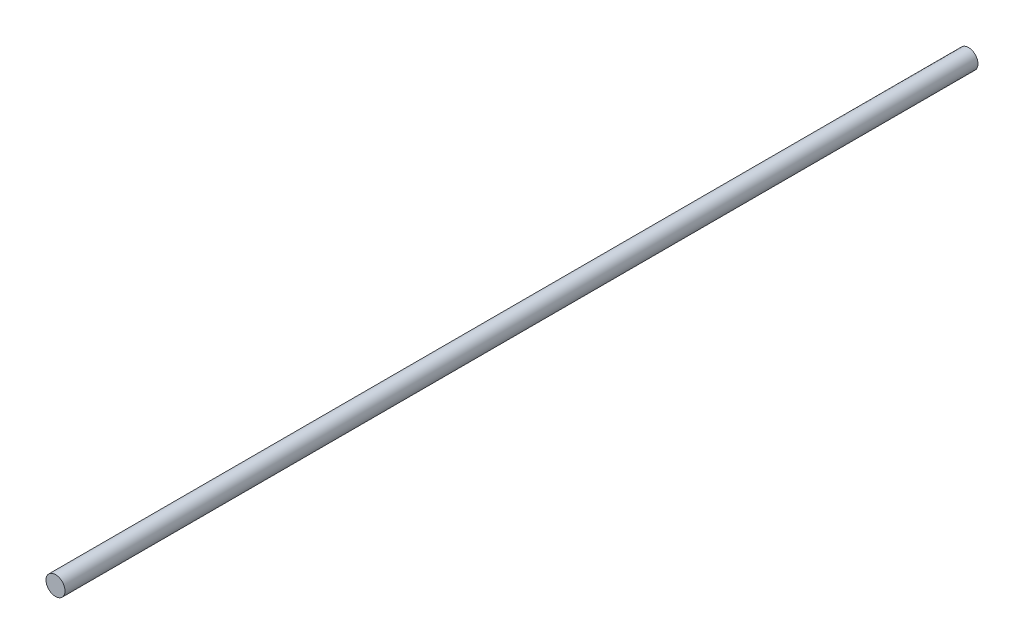
from build123d import *

# Parameters (mm, degrees)
SKETCH1_R           = 2
BOSS_EXTRUDE1_DEPTH = 192


with BuildPart() as part:
    # Sketch1 → Boss-Extrude1 (new body)
    with BuildSketch(Plane.XY):
        Circle(SKETCH1_R)
    extrude(amount=BOSS_EXTRUDE1_DEPTH)


solid = part.part
